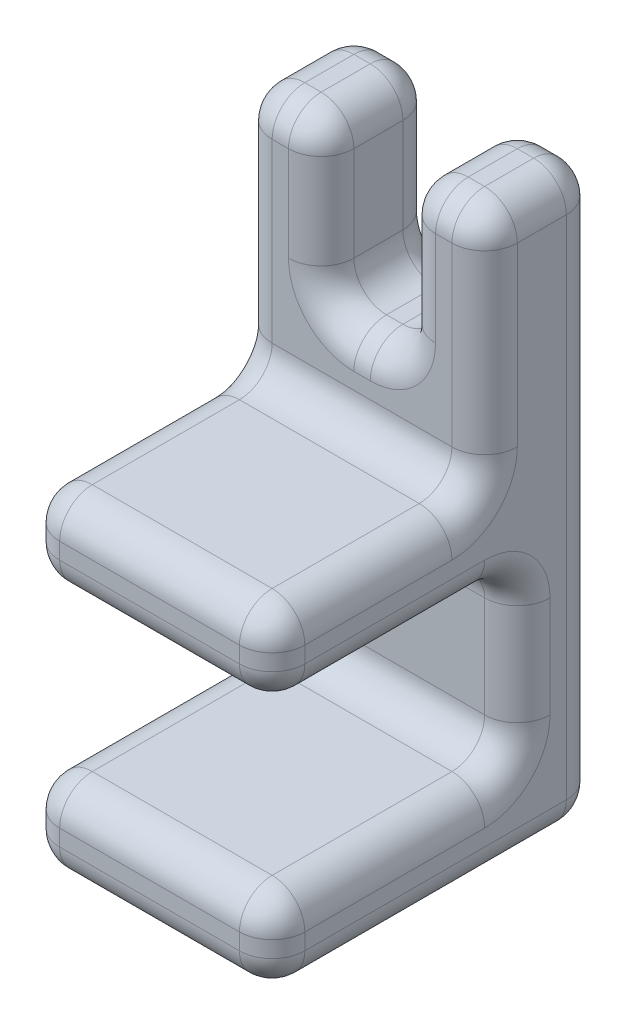
from build123d import *

# Parameters (mm, degrees)
SKETCH1_W                      = 15
SKETCH1_H                      = 35
BOSS_EXTRUDE1_DEPTH            = 20
SKETCH2_W                      = 15
SKETCH2_H                      = 10.2
CUT_EXTRUDE1_DEPTH             = 44.011626335
FILLET1_R                      = 2
SKETCH4_W                      = 13
SKETCH4_H                      = 14.8
CUT_EXTRUDE3_DEPTH             = 44.011626335
CUT_EXTRUDE4_REACH             = 45.012
SKETCH5_W                      = 5
SKETCH5_H                      = 9.8
CUT_EXTRUDE4_DIRECTION_2_DEPTH = 44.011626335
FILLET2_R                      = 2


with BuildPart() as part:
    # Sketch1 → Boss-Extrude1 (new body)
    with BuildSketch(Plane.XY):
        with Locations((-7.5, 17.5)):
            Rectangle(SKETCH1_W, SKETCH1_H)
    extrude(amount=BOSS_EXTRUDE1_DEPTH)

    # Sketch2 → Cut-Extrude1 (cut, through all)
    with BuildSketch(Plane(origin=(0, 0, 0), x_dir=(0, 0, -1), z_dir=(1, 0, 0))):
        with Locations((-12.5, 10.1)):
            Rectangle(SKETCH2_W, SKETCH2_H)
    extrude(amount=-CUT_EXTRUDE1_DEPTH, mode=Mode.SUBTRACT)

    # Fillet1
    fillet1_edges = [part.edges().sort_by_distance(p)[0] for p in [
        (-15, 15.2, 12.5),
        (-15, 10.1, 5),
        (-7.5, 15.2, 5),
        (-15, 5, 12.5),
        (-7.5, 5, 5),
        (0, 5, 12.5),
        (0, 10.1, 5),
        (0, 15.2, 12.5),
    ]]
    fillet(fillet1_edges, radius=FILLET1_R)

    # Sketch4 → Cut-Extrude3 (cut, through all)
    with BuildSketch(Plane.ZY.offset(15)):
        with Locations((13.5, 27.6)):
            Rectangle(SKETCH4_W, SKETCH4_H)
    extrude(amount=-CUT_EXTRUDE3_DEPTH, mode=Mode.SUBTRACT)

    # Sketch5 → Cut-Extrude4 (cut, up to next)
    with BuildSketch(Plane(origin=(0, 0, 0), x_dir=(-1, 0, 0), z_dir=(0, 0, -1)), mode=Mode.PRIVATE) as cut_extrude4_sk1:
        with Locations((7.5, 30.1)):
            Rectangle(SKETCH5_W, SKETCH5_H)
    cut_extrude4_tool1 = extrude(cut_extrude4_sk1.sketch, amount=-CUT_EXTRUDE4_REACH, mode=Mode.PRIVATE) & part.part
    add(cut_extrude4_tool1.solids().sort_by_distance((-7.5, 30.1, 0))[0], mode=Mode.SUBTRACT)

    # Sketch5 → Cut-Extrude4 direction 2 (cut)
    with BuildSketch(Plane(origin=(0, 0, 0), x_dir=(-1, 0, 0), z_dir=(0, 0, -1))):
        with Locations((7.5, 30.1)):
            Rectangle(SKETCH5_W, SKETCH5_H)
    extrude(amount=CUT_EXTRUDE4_DIRECTION_2_DEPTH, mode=Mode.SUBTRACT)

    # Fillet2
    fillet2_edges = [part.edges().sort_by_distance(p)[0] for p in [
        (-7.5, 0, 20),
        (-15, 1.5, 20),
        (-7.5, 5, 20),
        (-0.585786438, 4.414213562, 20),
        (-14.414213562, 4.414213562, 20),
        (0, 18.7, 20),
        (-7.5, 15.2, 20),
        (-0.585786438, 15.785786438, 20),
        (-14.414213562, 15.785786438, 20),
        (0, 1.5, 20),
        (-7.5, 0, 0),
        (-15, 17.5, 0),
        (-2.5, 35, 0),
        (0, 17.5, 0),
        (-15, 18.7, 20),
        (-15, 35, 3.5),
        (0, 35, 3.5),
        (0, 20.2, 13.5),
        (-7.5, 20.2, 20),
        (0, 27.6, 7),
        (-7.5, 20.2, 7),
        (-2.5, 35, 7),
        (-15, 27.6, 7),
        (-15, 20.2, 13.5),
        (-12.5, 35, 7),
        (0, 0, 10),
        (-15, 0, 10),
        (-12.5, 35, 0),
        (-5, 35, 3.5),
        (-5, 25.2, 3.5),
        (-10, 25.2, 3.5),
        (-10, 35, 3.5),
        (-5, 30.1, 0),
        (-7.5, 25.2, 0),
        (-10, 30.1, 0),
        (-7.5, 25.2, 7),
        (-5, 30.1, 7),
        (-10, 30.1, 7),
    ]]
    fillet(fillet2_edges, radius=FILLET2_R)


solid = part.part
